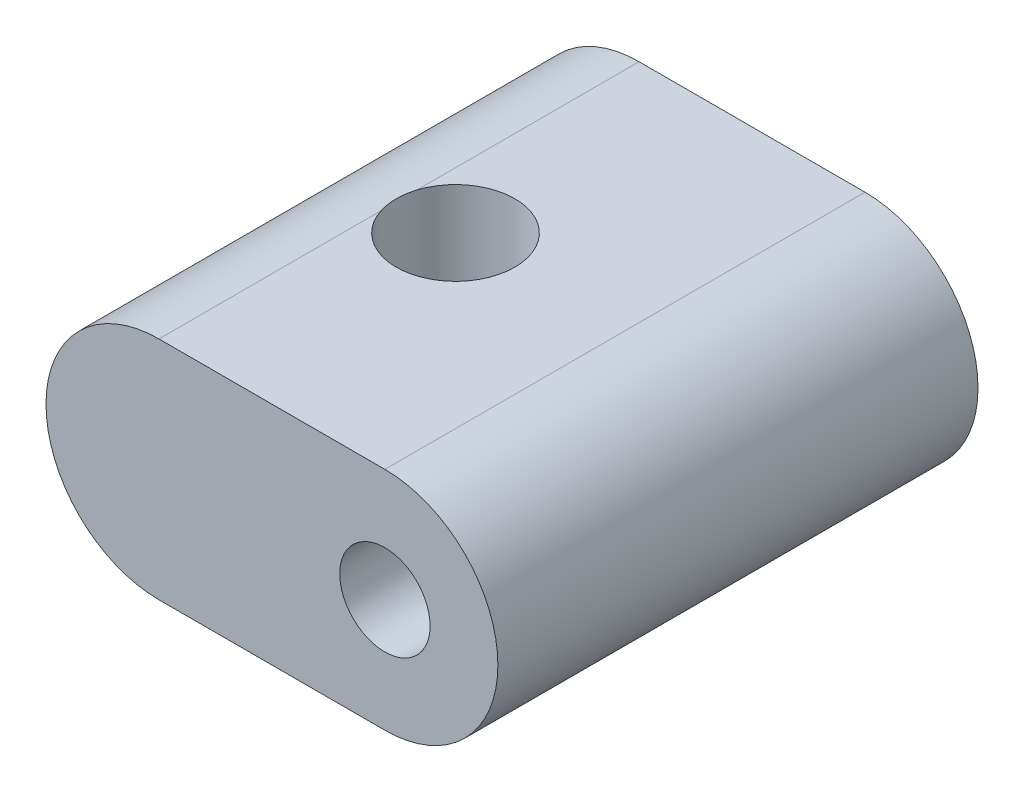
from build123d import *

# Parameters (mm, degrees)
SKETCH1_R           = 1.6
BOSS_EXTRUDE1_DEPTH = 17
SKETCH2_R           = 2.1
CUT_EXTRUDE1_DEPTH  = 27.305892876


with BuildPart() as part:
    # Sketch1 → Boss-Extrude1 (new body)
    with BuildSketch(Plane.XY.offset(5)):
        with BuildLine():
            Line((-8, -4), (0, -4))
            ThreePointArc((0, -4), (4, 0), (0, 4))
            Line((0, 4), (-8, 4))
            ThreePointArc((-8, 4), (-12, 0), (-8, -4))
        make_face()
        Circle(SKETCH1_R, mode=Mode.SUBTRACT)
    extrude(amount=BOSS_EXTRUDE1_DEPTH)

    # Sketch2 → Cut-Extrude1 (cut, through all)
    with BuildSketch(Plane(origin=(0, 4, 0), x_dir=(1, 0, 0), z_dir=(0, 1, 0))):
        with Locations(Location((-6, -13.5, 0), (0, 0, 197.752790162))):
            Circle(SKETCH2_R)
    extrude(amount=-CUT_EXTRUDE1_DEPTH, mode=Mode.SUBTRACT)


solid = part.part
